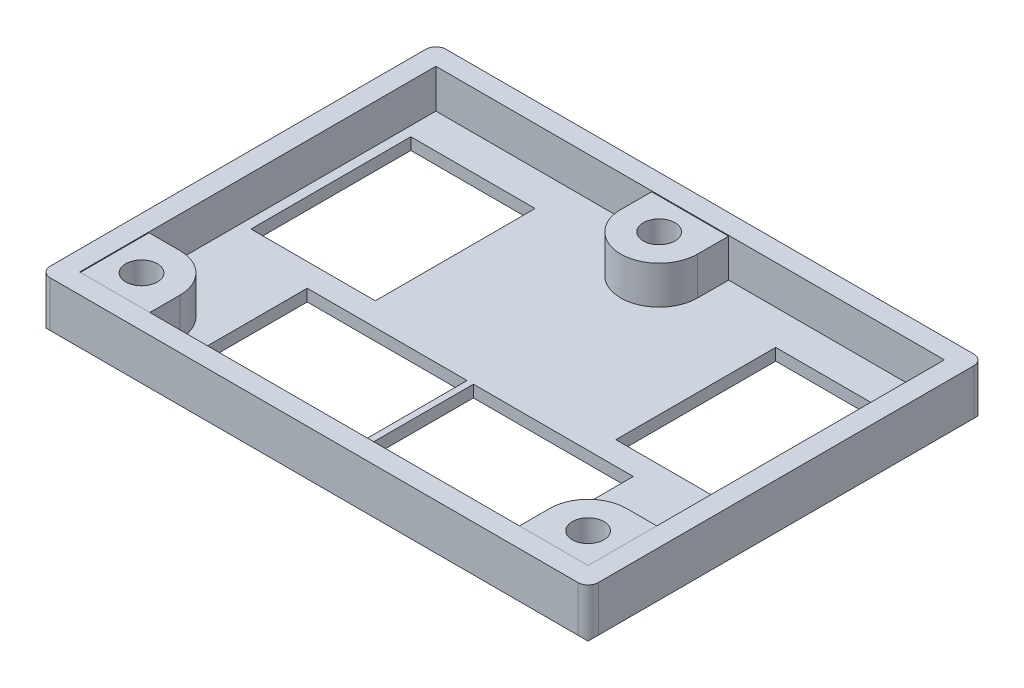
from build123d import *

# Parameters (mm, degrees)
SKETCH1_W           = 54
SKETCH1_H           = 39
BOSS_EXTRUDE1_DEPTH = 5
SKETCH2_W           = 50.1
SKETCH2_H           = 35.1
CUT_EXTRUDE1_DEPTH  = 0.0762
CUT_EXTRUDE2_DEPTH  = 3.75
SKETCH4_R           = 1.56
CUT_EXTRUDE3_DEPTH  = 34.667399758
SKETCH6_W           = 12.25
SKETCH6_H           = 15.75
SKETCH6_W_2         = 15.75
SKETCH6_H_2         = 12.5
CUT_EXTRUDE5_DEPTH  = 34.524465789
CHAMFER1_SIZE       = 0.5
FILLET1_R           = 1


with BuildPart() as part:
    # Sketch1 → Boss-Extrude1 (new body)
    with BuildSketch(Plane(origin=(0, 0, 0), x_dir=(1, 0, 0), z_dir=(0, 1, 0))):
        Rectangle(SKETCH1_W, SKETCH1_H)
    extrude(amount=BOSS_EXTRUDE1_DEPTH)

    # Sketch2 → Cut-Extrude1 (cut)
    with BuildSketch(Plane(origin=(0, 5, 0), x_dir=(1, 0, 0), z_dir=(0, 1, 0))):
        Rectangle(SKETCH2_W, SKETCH2_H)
    extrude(amount=-CUT_EXTRUDE1_DEPTH, mode=Mode.SUBTRACT)

    # Sketch3 → Cut-Extrude2 (cut)
    with BuildSketch(Plane(origin=(0, 4.9238, 0), x_dir=(1, 0, 0), z_dir=(0, 1, 0))):
        with BuildLine():
            Line((-3.79, 14.5), (-3.79, 17.55))
            Line((-3.79, 17.55), (-25.05, 17.55))
            Line((-25.05, 17.55), (-25.05, -10.71))
            Line((-25.05, -10.71), (-22, -10.71))
            ThreePointArc((-22, -10.71), (-19.320065299, -11.820065299), (-18.21, -14.5))
            Line((-18.21, -14.5), (-18.21, -17.55))
            Line((-18.21, -17.55), (18.21, -17.55))
            Line((18.21, -17.55), (18.21, -14.5))
            ThreePointArc((18.21, -14.5), (19.320065299, -11.820065299), (22, -10.71))
            Line((22, -10.71), (25.05, -10.71))
            Line((25.05, -10.71), (25.05, 17.55))
            Line((25.05, 17.55), (3.79, 17.55))
            Line((3.79, 17.55), (3.79, 14.5))
            ThreePointArc((3.79, 14.5), (0, 10.71), (-3.79, 14.5))
        make_face()
    extrude(amount=-CUT_EXTRUDE2_DEPTH, mode=Mode.SUBTRACT)

    # Sketch4 → Cut-Extrude3 (cut, through all)
    with BuildSketch(Plane(origin=(0, 4.9238, 0), x_dir=(1, 0, 0), z_dir=(0, 1, 0))):
        with Locations(Location((0, 14.5, 0), (0, 0, 270))):
            Circle(SKETCH4_R)
        with Locations(Location((-22, -14.5, 0), (0, 0, 270))):
            Circle(SKETCH4_R)
        with Locations(Location((22, -14.5, 0), (0, 0, 90))):
            Circle(SKETCH4_R)
    extrude(amount=-CUT_EXTRUDE3_DEPTH, mode=Mode.SUBTRACT)

    # Sketch6 → Cut-Extrude5 (cut, through all)
    with BuildSketch(Plane(origin=(0, 1.1738, 0), x_dir=(1, 0, 0), z_dir=(0, 1, 0))):
        with Locations((17.975, 6.255)):
            Rectangle(SKETCH6_W, SKETCH6_H)
        with Locations((7.975, -10.15)):
            Rectangle(SKETCH6_W_2, SKETCH6_H_2)
        with Locations((-17.975, 6.255)):
            Rectangle(SKETCH6_W, SKETCH6_H)
        with Locations((-8.4, -10.15)):
            Rectangle(SKETCH6_W_2, SKETCH6_H_2)
    extrude(amount=-CUT_EXTRUDE5_DEPTH, mode=Mode.SUBTRACT)

    # Chamfer1
    chamfer1_edges = [part.edges().sort_by_distance(p)[0] for p in [
        (-27, 0, 0),
        (0, 0, -19.5),
        (27, 0, 0),
        (0, 0, 19.5),
    ]]
    chamfer(chamfer1_edges, length=CHAMFER1_SIZE)

    # Fillet1
    fillet1_edges = [part.edges().sort_by_distance(p)[0] for p in [
        (-27, 2.75, 19.5),
        (-27, 2.75, -19.5),
        (27, 2.75, -19.5),
        (27, 2.75, 19.5),
    ]]
    fillet(fillet1_edges, radius=FILLET1_R)


solid = part.part
